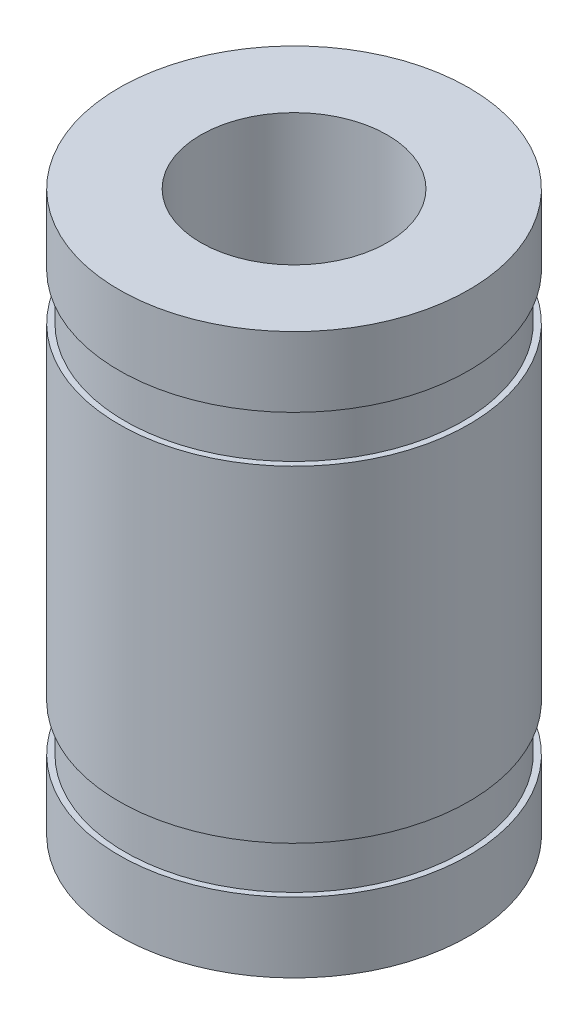
from build123d import *


with BuildPart() as part:
    # Sketch1 → Revolve1 (revolve)
    with BuildSketch(Plane.XY, mode=Mode.PRIVATE) as revolve1_sk:
        Polygon((4, 0), (4, -12), (7.5, -12), (7.5, -9), (7.25, -9), (7.25, -7), (7.5, -7), (7.5, 0), align=None)
    revolve1 = revolve(revolve1_sk.sketch.rotate(Axis((0, -6.058624222, 0), (0, 1, 0)), 90), axis=Axis((0, -6.058624222, 0), (0, 1, 0)))

    # Mirror1: Revolve1 across plane
    add(revolve1.mirror(Plane.ZX))


solid = part.part
